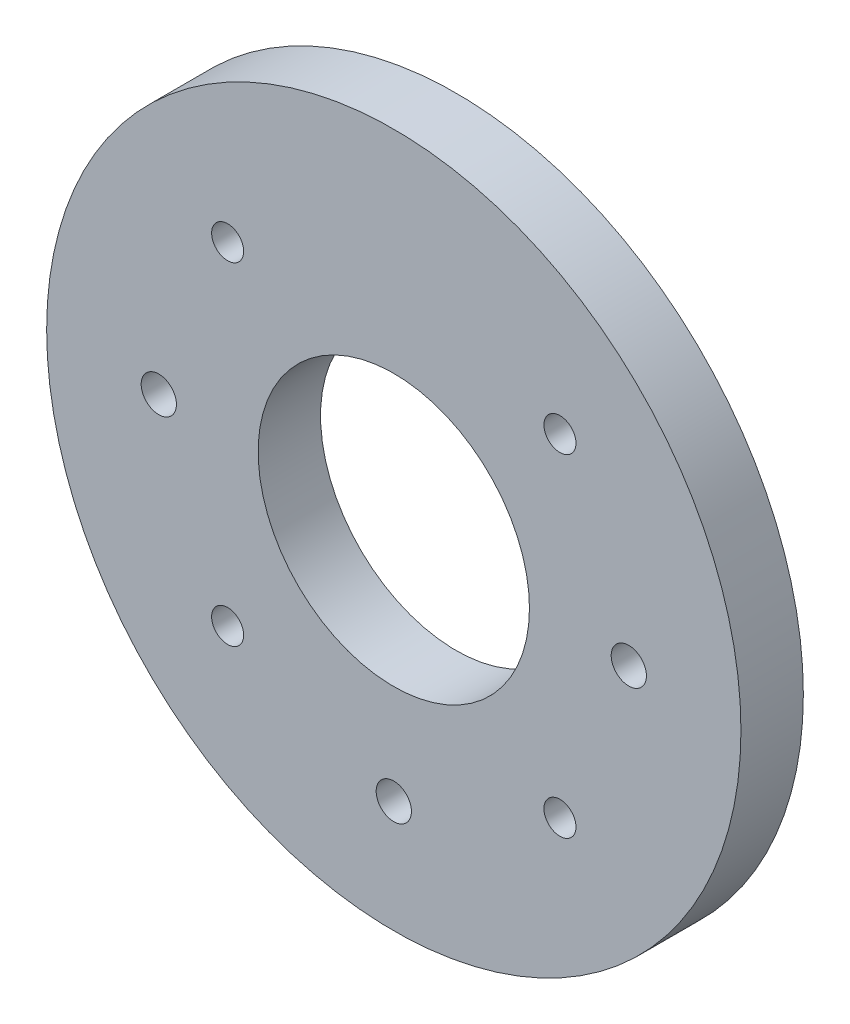
from build123d import *

# Parameters (mm, degrees)
SKETCH1_R           = 32.5
SKETCH1_R_2         = 12.7
SKETCH1_R_3         = 1.65
BOSS_EXTRUDE1_DEPTH = 5.842
SKETCH2_R           = 1.5
CUT_EXTRUDE2_DEPTH  = 47.331727401


with BuildPart() as part:
    # Sketch1 → Boss-Extrude1 (new body)
    with BuildSketch(Plane.XY):
        Circle(SKETCH1_R)
        Circle(SKETCH1_R_2, mode=Mode.SUBTRACT)
        with Locations((22, 0)):
            Circle(SKETCH1_R_3, mode=Mode.SUBTRACT)
        with Locations((0, -22)):
            Circle(SKETCH1_R_3, mode=Mode.SUBTRACT)
        with Locations((-22, 0)):
            Circle(SKETCH1_R_3, mode=Mode.SUBTRACT)
    extrude(amount=BOSS_EXTRUDE1_DEPTH)

    # Sketch2 → Cut-Extrude2 (cut, through all)
    with BuildSketch(Plane.XY.offset(5.842)):
        with Locations((-15.556349186, -15.556349186)):
            Circle(SKETCH2_R)
        with Locations((-15.556349186, 15.556349186)):
            Circle(SKETCH2_R)
        with Locations((15.556349186, 15.556349186)):
            Circle(SKETCH2_R)
        with Locations((15.556349186, -15.556349186)):
            Circle(SKETCH2_R)
    extrude(amount=-CUT_EXTRUDE2_DEPTH, mode=Mode.SUBTRACT)


solid = part.part
